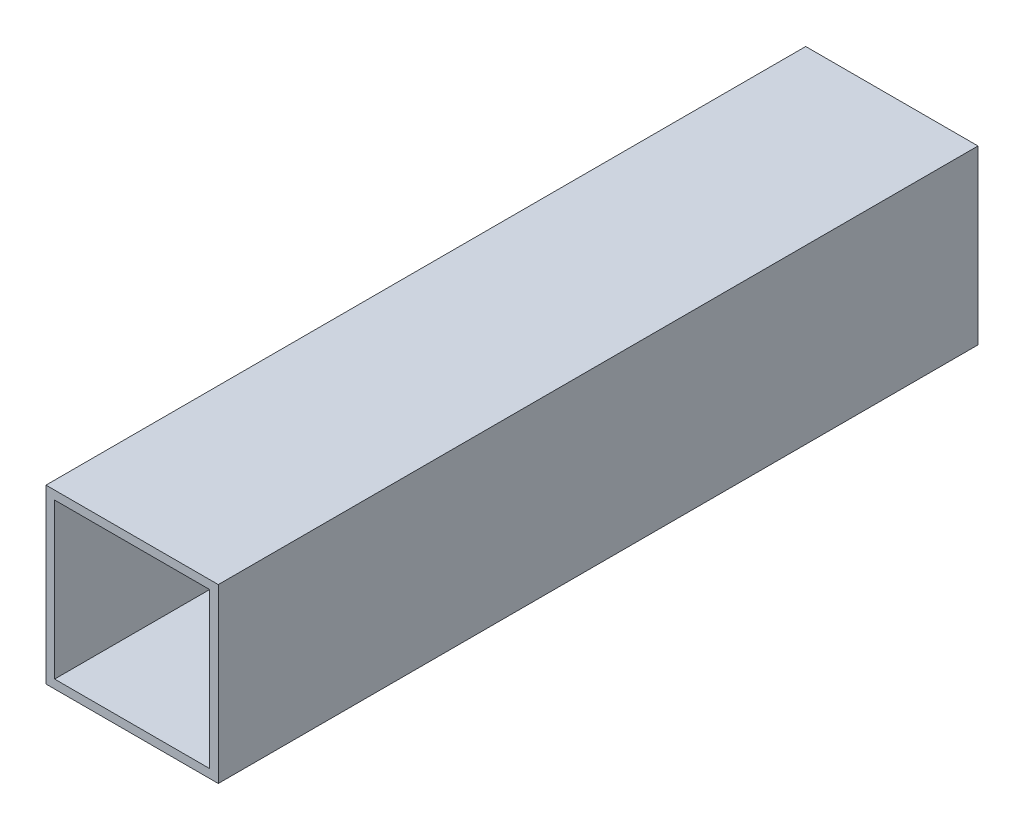
from build123d import *

# Parameters (mm, degrees)
SKETCH1_W           = 31.75
SKETCH1_H           = 31.75
SKETCH1_W_2         = 28.575
SKETCH1_H_2         = 28.575
BOSS_EXTRUDE1_DEPTH = 140


with BuildPart() as part:
    # Sketch1 → Boss-Extrude1 (new body)
    with BuildSketch(Plane.XY):
        Rectangle(SKETCH1_W, SKETCH1_H)
        Rectangle(SKETCH1_W_2, SKETCH1_H_2, mode=Mode.SUBTRACT)
    extrude(amount=BOSS_EXTRUDE1_DEPTH)


solid = part.part
